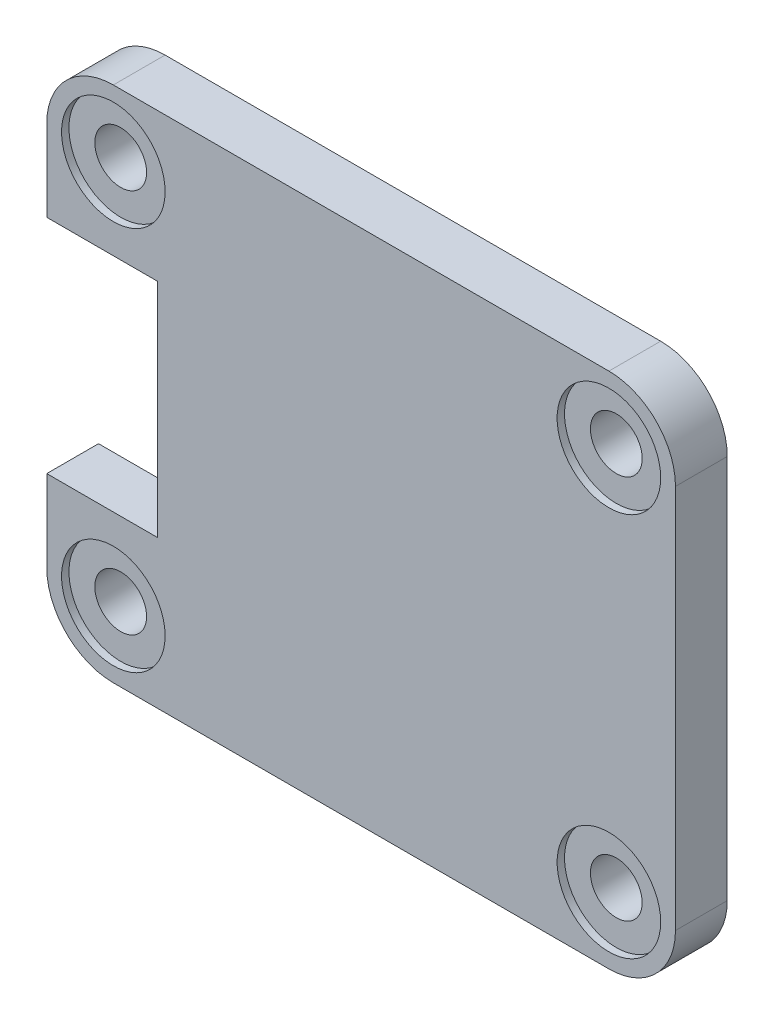
from build123d import *

# Parameters (mm, degrees)
BOSS_EXTRUDE1_DEPTH = 14
SKETCH10_R          = 7
CUT_EXTRUDE1_DEPTH  = 14
SKETCH11_R          = 14
CUT_EXTRUDE3_DEPTH  = 2
SKETCH12_W          = 30
SKETCH12_H          = 60
CUT_EXTRUDE4_DEPTH  = 14


with BuildPart() as part:
    # Sketch9 → Boss-Extrude1 (new body)
    with BuildSketch(Plane.XY):
        with BuildLine():
            Line((-67, 70), (67, 70))
            ThreePointArc((67, 70), (79.727922061, 64.727922061), (85, 52))
            Line((85, 52), (85, -52))
            ThreePointArc((85, -52), (79.727922061, -64.727922061), (67, -70))
            Line((67, -70), (-67, -70))
            ThreePointArc((-67, -70), (-79.727922061, -64.727922061), (-85, -52))
            Line((-85, -52), (-85, 52))
            ThreePointArc((-85, 52), (-79.727922061, 64.727922061), (-67, 70))
        make_face()
    extrude(amount=-BOSS_EXTRUDE1_DEPTH)

    # Sketch10 → Cut-Extrude1 (cut)
    with BuildSketch(Plane.XY):
        with Locations((67, 52)):
            Circle(SKETCH10_R)
        with Locations(Location((-67, 52, 0), (0, 0, 180))):
            Circle(SKETCH10_R)
        with Locations(Location((67, -52, 0), (0, 0, 180))):
            Circle(SKETCH10_R)
        with Locations((-67, -52)):
            Circle(SKETCH10_R)
    extrude(amount=-CUT_EXTRUDE1_DEPTH, mode=Mode.SUBTRACT)

    # Sketch11 → Cut-Extrude3 (cut)
    with BuildSketch(Plane.XY):
        with Locations((-67, 52)):
            Circle(SKETCH11_R)
        with Locations((67, 52)):
            Circle(SKETCH11_R)
        with Locations((67, -52)):
            Circle(SKETCH11_R)
        with Locations((-67, -52)):
            Circle(SKETCH11_R)
    extrude(amount=-CUT_EXTRUDE3_DEPTH, mode=Mode.SUBTRACT)

    # Sketch12 → Cut-Extrude4 (cut)
    with BuildSketch(Plane.XY):
        with Locations((-70, 0)):
            Rectangle(SKETCH12_W, SKETCH12_H)
    extrude(amount=-CUT_EXTRUDE4_DEPTH, mode=Mode.SUBTRACT)


solid = part.part
